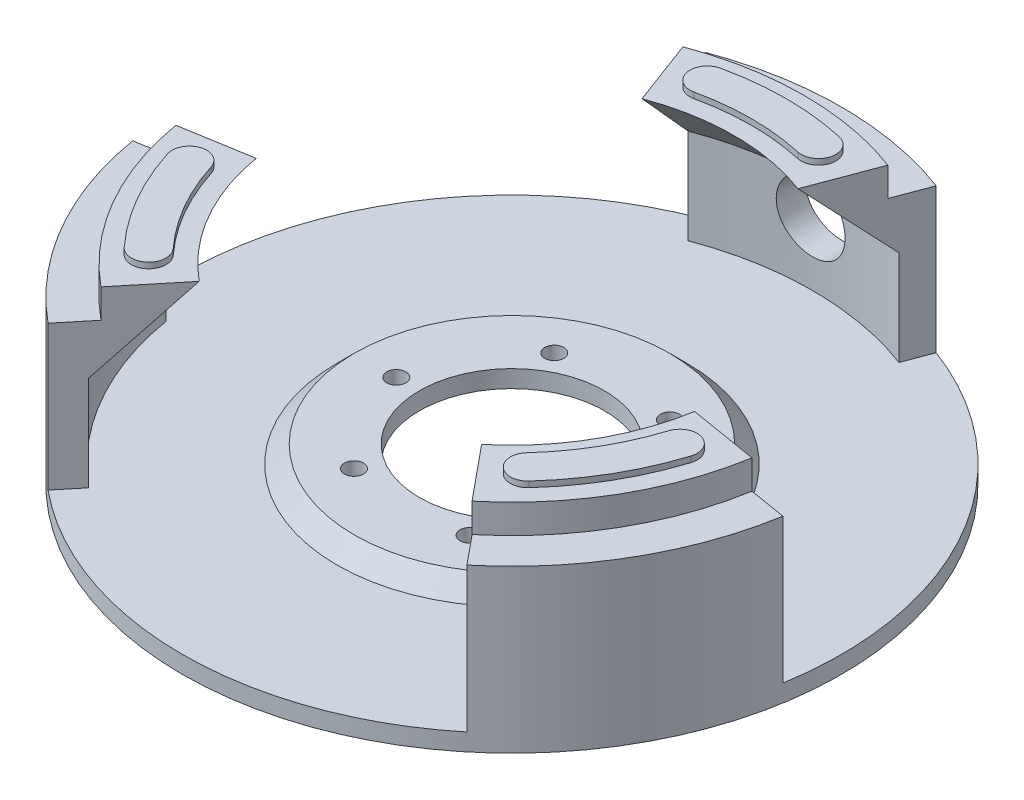
from build123d import *

# Parameters (mm, degrees)
CUT_EXTRUDE1_DEPTH  = 87.011627121
CIRPATTERN1_COUNT   = 3
BOSS_EXTRUDE1_DEPTH = 1
CIRPATTERN2_COUNT   = 3
SKETCH4_R           = 1.65
CUT_EXTRUDE2_DEPTH  = 86.334635407
CIRPATTERN3_COUNT   = 6
SKETCH5_R           = 5.95
CUT_EXTRUDE3_DEPTH  = 84.054199171


with BuildPart() as part:
    # Sketch1 → Revolve1 (revolve)
    with BuildSketch(Plane.XY, mode=Mode.PRIVATE) as revolve1_sk:
        Polygon((50.5, 19), (50.5, 14), (57, 14), (57, -14), (26, -14), (26, -11), (16, -11), (16, -8), (27.242640687, -8), (30.242640687, -11), (52, -11), (52, 5.428932188), (38.428932188, 19), align=None)
    revolve(revolve1_sk.sketch.rotate(Axis((0, 34.277777778, 0), (0, -1, 0)), 90), axis=Axis((0, 34.277777778, 0), (0, -1, 0)))

    # Sketch2 → Cut-Extrude1 (cut, through all)
    with BuildSketch(Plane(origin=(0, -11, 0), x_dir=(1, 0, 0), z_dir=(0, 1, 0))):
        with BuildLine():
            Line((20, 53.37602458), (12.98245614, 34.647594903))
            ThreePointArc((12.98245614, 34.647594903), (32.04293994, 18.5), (36.496925436, -6.08066063))
            Line((36.496925436, -6.08066063), (56.22499324, -9.367504214))
            ThreePointArc((56.22499324, -9.367504214), (49.363448016, 28.5), (20, 53.37602458))
        make_face()
    cut_extrude1 = extrude(amount=CUT_EXTRUDE1_DEPTH, mode=Mode.SUBTRACT)

    # CirPattern1: Cut-Extrude1 ×3 about axis
    cirpattern1_axis = Axis((0, 0, 0), (0, 1, 0))
    for i in range(1, CIRPATTERN1_COUNT):
        add(cut_extrude1.rotate(cirpattern1_axis, i * 360 / CIRPATTERN1_COUNT), mode=Mode.SUBTRACT)

    # Sketch3 → Boss-Extrude1 (add)
    with BuildSketch(Plane(origin=(0, 19, 0), x_dir=(1, 0, 0), z_dir=(0, 1, 0))):
        with BuildLine():
            ThreePointArc((10.273190717, 46.339368728), (0, 47.464466094), (-10.273190717, 46.339368728))
            ThreePointArc((-10.273190717, 46.339368728), (-12.552759897, 42.761161865), (-8.974553034, 40.481592685))
            ThreePointArc((-8.974553034, 40.481592685), (0, 41.464466094), (8.974553034, 40.481592685))
            ThreePointArc((8.974553034, 40.481592685), (12.552759897, 42.761161865), (10.273190717, 46.339368728))
        make_face()
    boss_extrude1 = extrude(amount=BOSS_EXTRUDE1_DEPTH)

    # CirPattern2: Boss-Extrude1 ×3 about axis
    cirpattern2_axis = Axis((0, 0, 0), (0, 1, 0))
    for i in range(1, CIRPATTERN2_COUNT):
        add(boss_extrude1.rotate(cirpattern2_axis, i * 360 / CIRPATTERN2_COUNT))

    # Sketch4 → Cut-Extrude2 (cut, through all)
    with BuildSketch(Plane(origin=(0, -8, 0), x_dir=(1, 0, 0), z_dir=(0, 1, 0))):
        with Locations(Location((20, 0, 0), (0, 0, 270))):
            Circle(SKETCH4_R)
    cut_extrude2 = extrude(amount=-CUT_EXTRUDE2_DEPTH, mode=Mode.SUBTRACT)

    # CirPattern3: Cut-Extrude2 ×6 about axis
    cirpattern3_axis = Axis((0, 0, 0), (0, 1, 0))
    for i in range(1, CIRPATTERN3_COUNT):
        add(cut_extrude2.rotate(cirpattern3_axis, i * 360 / CIRPATTERN3_COUNT), mode=Mode.SUBTRACT)

    # Sketch5 → Cut-Extrude3 (cut, through all)
    with BuildSketch(Plane.XY):
        with Locations(Location((0, 0, 0), (0, 0, 65.842722295))):
            Circle(SKETCH5_R)
    extrude(amount=-CUT_EXTRUDE3_DEPTH, mode=Mode.SUBTRACT)


solid = part.part
